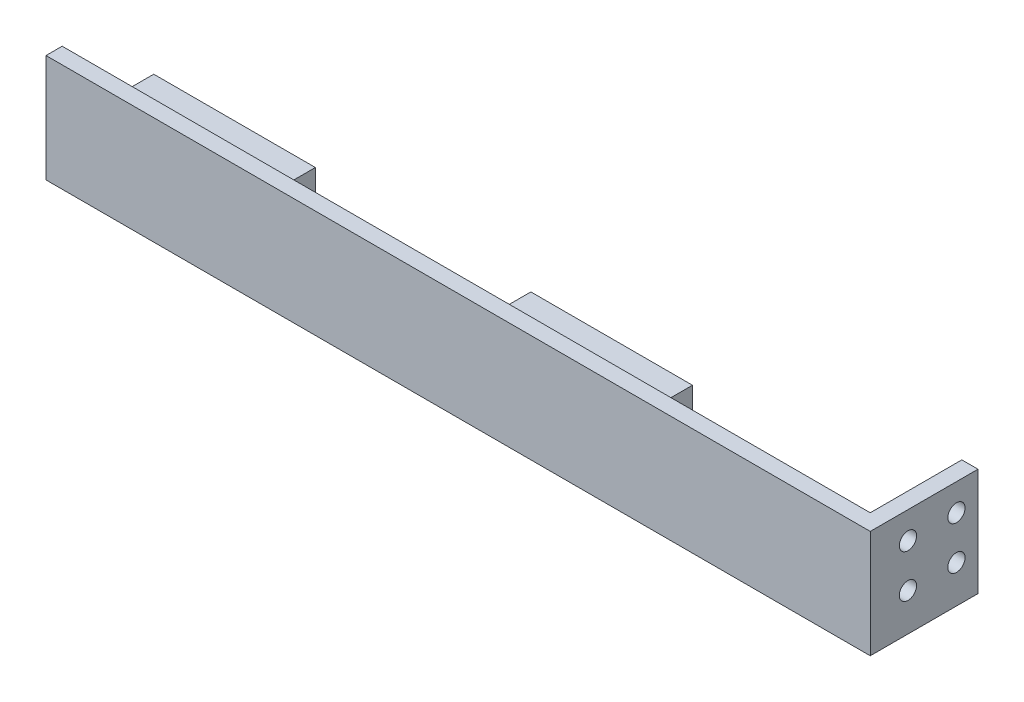
from build123d import *

# Parameters (mm, degrees)
SKETCH1_W           = 20
SKETCH1_H           = 20
BOSS_EXTRUDE1_DEPTH = 3
SKETCH2_W           = 3
SKETCH2_H           = 20
BOSS_EXTRUDE2_DEPTH = 150
SKETCH3_W           = 17
SKETCH3_H           = 3
BOSS_EXTRUDE3_DEPTH = 150
SKETCH4_R           = 1.6
CUT_EXTRUDE1_DEPTH  = 3
SKETCH5_W           = 30
SKETCH5_H           = 17
BOSS_EXTRUDE4_DEPTH = 4
SKETCH6_W           = 30
SKETCH6_H           = 17
BOSS_EXTRUDE5_DEPTH = 4
SKETCH9_R           = 2.05
SKETCH9_R_2         = 2.1
CUT_EXTRUDE4_DEPTH  = 186.434844337
SKETCH10_R          = 4
CUT_EXTRUDE5_DEPTH  = 2.5
CHAMFER3_SIZE       = 3
SKETCH12_W          = 3.1
SKETCH12_H          = 17
CUT_EXTRUDE7_DEPTH  = 3


with BuildPart() as part:
    # Sketch1 → Boss-Extrude1 (new body)
    with BuildSketch(Plane(origin=(0, 0, 0), x_dir=(0, 0, -1), z_dir=(1, 0, 0))):
        with Locations((-98.245468701, -9.501201475)):
            Rectangle(SKETCH1_W, SKETCH1_H)
    extrude(amount=BOSS_EXTRUDE1_DEPTH)

    # Sketch2 → Boss-Extrude2 (add)
    with BuildSketch(Plane.ZY):
        with Locations((106.745468701, -9.501201475)):
            Rectangle(SKETCH2_W, SKETCH2_H)
    extrude(amount=BOSS_EXTRUDE2_DEPTH)

    # Sketch3 → Boss-Extrude3 (add)
    with BuildSketch(Plane.ZY):
        with Locations((96.745468701, -18.001201475)):
            Rectangle(SKETCH3_W, SKETCH3_H)
    extrude(amount=BOSS_EXTRUDE3_DEPTH)

    # Sketch4 → Cut-Extrude1 (cut)
    with BuildSketch(Plane(origin=(3, 0, 0), x_dir=(0, 0, -1), z_dir=(1, 0, 0))):
        with Locations((-101.245468701, -4.501201475)):
            Circle(SKETCH4_R)
        with Locations((-92.245468701, -4.501201475)):
            Circle(SKETCH4_R)
        with Locations((-92.245468701, -12.501201475)):
            Circle(SKETCH4_R)
        with Locations((-101.245468701, -12.501201475)):
            Circle(SKETCH4_R)
    extrude(amount=-CUT_EXTRUDE1_DEPTH, mode=Mode.SUBTRACT)

    # Sketch5 → Boss-Extrude4 (add)
    with BuildSketch(Plane(origin=(0, -16.501201475, 0), x_dir=(1, 0, 0), z_dir=(0, 1, 0))):
        with Locations((-135, -96.745468701)):
            Rectangle(SKETCH5_W, SKETCH5_H)
    extrude(amount=BOSS_EXTRUDE4_DEPTH)

    # Sketch6 → Boss-Extrude5 (add)
    with BuildSketch(Plane(origin=(0, -16.501201475, 0), x_dir=(1, 0, 0), z_dir=(0, 1, 0))):
        with Locations((-65, -96.745468701)):
            Rectangle(SKETCH6_W, SKETCH6_H)
    extrude(amount=BOSS_EXTRUDE5_DEPTH)

    # Sketch9 → Cut-Extrude4 (cut, through all)
    with BuildSketch(Plane(origin=(0, -12.501201475, 0), x_dir=(1, 0, 0), z_dir=(0, 1, 0))):
        with Locations(Location((-58, -96.745468701, 0), (0, 0, 270))):
            Circle(SKETCH9_R)
        with Locations(Location((-72, -96.745468701, 0), (0, 0, 270))):
            Circle(SKETCH9_R_2)
        with Locations(Location((-128, -96.745468701, 0), (0, 0, 270))):
            Circle(SKETCH9_R_2)
        with Locations(Location((-142, -96.745468701, 0), (0, 0, 270))):
            Circle(SKETCH9_R_2)
    extrude(amount=-CUT_EXTRUDE4_DEPTH, mode=Mode.SUBTRACT)

    # Sketch10 → Cut-Extrude5 (cut)
    with BuildSketch(Plane.XZ.offset(19.501201475)):
        with Locations(Location((-142, 96.745468701, 0), (0, 0, 270))):
            Circle(SKETCH10_R)
        with Locations(Location((-128, 96.745468701, 0), (0, 0, 270))):
            Circle(SKETCH10_R)
        with Locations(Location((-72, 96.745468701, 0), (0, 0, 270))):
            Circle(SKETCH10_R)
        with Locations(Location((-58, 96.745468701, 0), (0, 0, 270))):
            Circle(SKETCH10_R)
    extrude(amount=-CUT_EXTRUDE5_DEPTH, mode=Mode.SUBTRACT)

    # Chamfer3
    chamfer3_edges = [part.edges().sort_by_distance(p)[0] for p in [
        (-100, -16.501201475, 105.245468701),
        (-25, -16.501201475, 105.245468701),
    ]]
    chamfer(chamfer3_edges, length=CHAMFER3_SIZE)

    # Sketch12 → Cut-Extrude7 (cut)
    with BuildSketch(Plane(origin=(0, -16.501201475, 0), x_dir=(1, 0, 0), z_dir=(0, 1, 0))):
        with Locations((-118.45, -96.745468701)):
            Rectangle(SKETCH12_W, SKETCH12_H)
        with Locations((-81.55, -96.745468701)):
            Rectangle(SKETCH12_W, SKETCH12_H)
        with Locations((-48.45, -96.745468701)):
            Rectangle(SKETCH12_W, SKETCH12_H)
    extrude(amount=CUT_EXTRUDE7_DEPTH, mode=Mode.SUBTRACT)


solid = part.part
